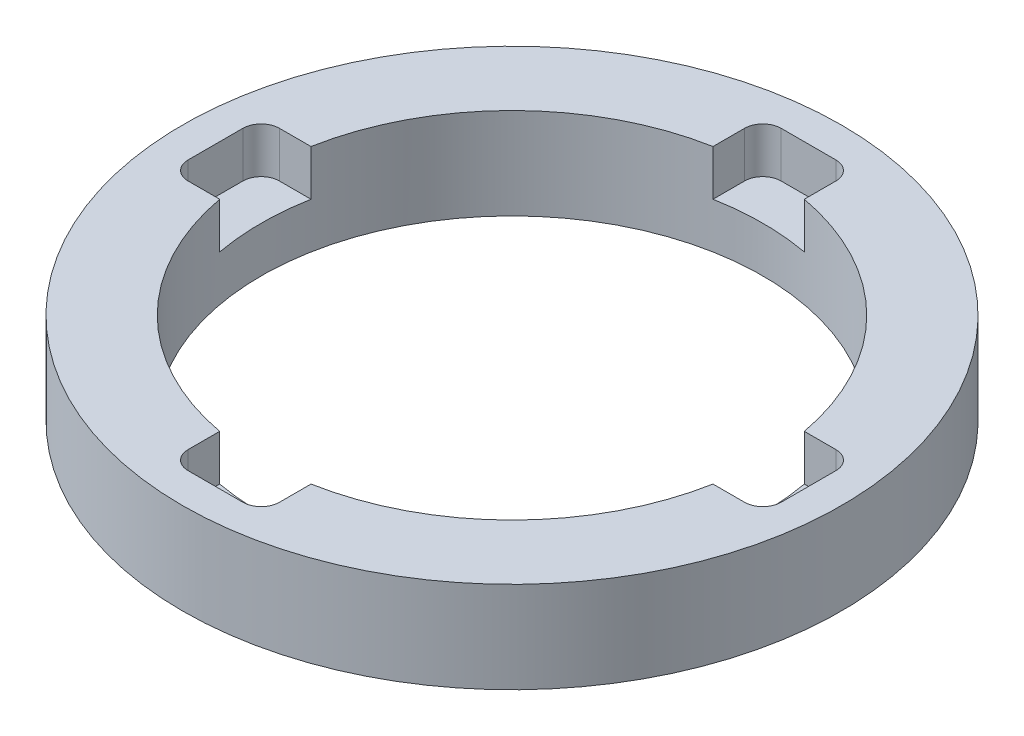
from build123d import *

# Parameters (mm, degrees)
SKETCH1_R           = 45.8343
SKETCH1_R_2         = 34.8869
BOSS_EXTRUDE1_DEPTH = 12.7
CUT_EXTRUDE1_START  = -6.35
CUT_EXTRUDE1_DEPTH  = 6.35
CIRPATTERN1_COUNT   = 4


with BuildPart() as part:
    # Sketch1 → Boss-Extrude1 (new body)
    with BuildSketch(Plane(origin=(0, 0, 0), x_dir=(1, 0, 0), z_dir=(0, 1, 0))):
        with Locations(Location((0, 0, 0), (0, 0, 270))):
            Circle(SKETCH1_R)
        with Locations(Location((0, 0, 0), (0, 0, 270))):
            Circle(SKETCH1_R_2, mode=Mode.SUBTRACT)
    extrude(amount=BOSS_EXTRUDE1_DEPTH)

    # Sketch2 → Cut-Extrude1 (cut)
    with BuildSketch(Plane(origin=(0, 12.7, 0), x_dir=(1, 0, 0), z_dir=(0, 1, 0)).offset(CUT_EXTRUDE1_START)):
        with BuildLine():
            Line((6.35, 34.304129367), (6.35, 38.6969))
            ThreePointArc((6.35, 38.6969), (5.606051224, 40.492951224), (3.81, 41.2369))
            Line((3.81, 41.2369), (-3.81, 41.2369))
            ThreePointArc((-3.81, 41.2369), (-5.606051224, 40.492951224), (-6.35, 38.6969))
            Line((-6.35, 38.6969), (-6.35, 34.304129367))
            ThreePointArc((-6.35, 34.304129367), (0, 34.8869), (6.35, 34.304129367))
        make_face()
    cut_extrude1 = extrude(amount=CUT_EXTRUDE1_DEPTH, mode=Mode.SUBTRACT)

    # CirPattern1: Cut-Extrude1 ×4 about axis
    cirpattern1_axis = Axis((0, 0, 0), (0, 1, 0))
    for i in range(1, CIRPATTERN1_COUNT):
        add(cut_extrude1.rotate(cirpattern1_axis, i * 360 / CIRPATTERN1_COUNT), mode=Mode.SUBTRACT)


solid = part.part
